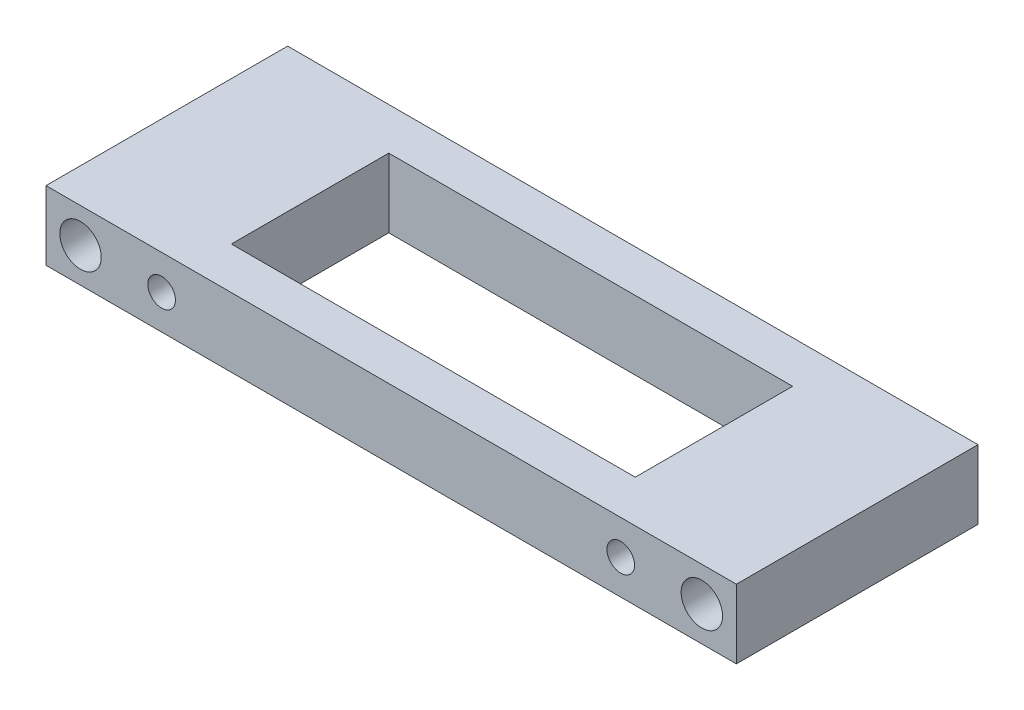
from build123d import *

# Parameters (mm, degrees)
SKETCH1_W           = 100
SKETCH1_H           = 20
SKETCH1_R           = 6
SKETCH1_R_2         = 4
BOSS_EXTRUDE1_DEPTH = 40
SKETCH2_W           = 100
SKETCH2_H           = 20
BOSS_EXTRUDE2_DEPTH = 30
CUT_EXTRUDE1_REACH  = 111.545
SKETCH3_W           = 58.5
SKETCH3_H           = 45.6


with BuildPart() as part:
    # Sketch1 → Boss-Extrude1 (new body)
    with BuildSketch(Plane.XY):
        with Locations((-50, 10)):
            Rectangle(SKETCH1_W, SKETCH1_H)
        with Locations((-90, 10)):
            Circle(SKETCH1_R, mode=Mode.SUBTRACT)
        with Locations((-66.5, 10)):
            Circle(SKETCH1_R_2, mode=Mode.SUBTRACT)
    boss_extrude1 = extrude(amount=BOSS_EXTRUDE1_DEPTH)

    # Sketch2 → Boss-Extrude2 (add)
    with BuildSketch(Plane(origin=(0, 0, 0), x_dir=(-1, 0, 0), z_dir=(0, 0, -1))):
        with Locations((50, 10)):
            Rectangle(SKETCH2_W, SKETCH2_H)
    boss_extrude2 = extrude(amount=BOSS_EXTRUDE2_DEPTH)

    # Sketch3 → Cut-Extrude1 (cut, up to next)
    with BuildSketch(Plane(origin=(0, 20, 0), x_dir=(1, 0, 0), z_dir=(0, 1, 0)), mode=Mode.PRIVATE) as cut_extrude1_sk1:
        with Locations((-29.25, -5)):
            Rectangle(SKETCH3_W, SKETCH3_H)
    cut_extrude1_tool1 = extrude(cut_extrude1_sk1.sketch, amount=-CUT_EXTRUDE1_REACH, mode=Mode.PRIVATE) & part.part
    cut_extrude1 = cut_extrude1_tool1.solids().sort_by_distance((-29.25, 20, 5))[0]
    add(cut_extrude1, mode=Mode.SUBTRACT)

    # Mirror2: Boss-Extrude1, Boss-Extrude2, Cut-Extrude1 across plane
    add(boss_extrude1.mirror(Plane(origin=(0, 0, 40), x_dir=(0, 0, 1), z_dir=(-1, 0, 0))))
    add(boss_extrude2.mirror(Plane(origin=(0, 0, 40), x_dir=(0, 0, 1), z_dir=(-1, 0, 0))))
    add(cut_extrude1.mirror(Plane(origin=(0, 0, 40), x_dir=(0, 0, 1), z_dir=(-1, 0, 0))), mode=Mode.SUBTRACT)


solid = part.part
